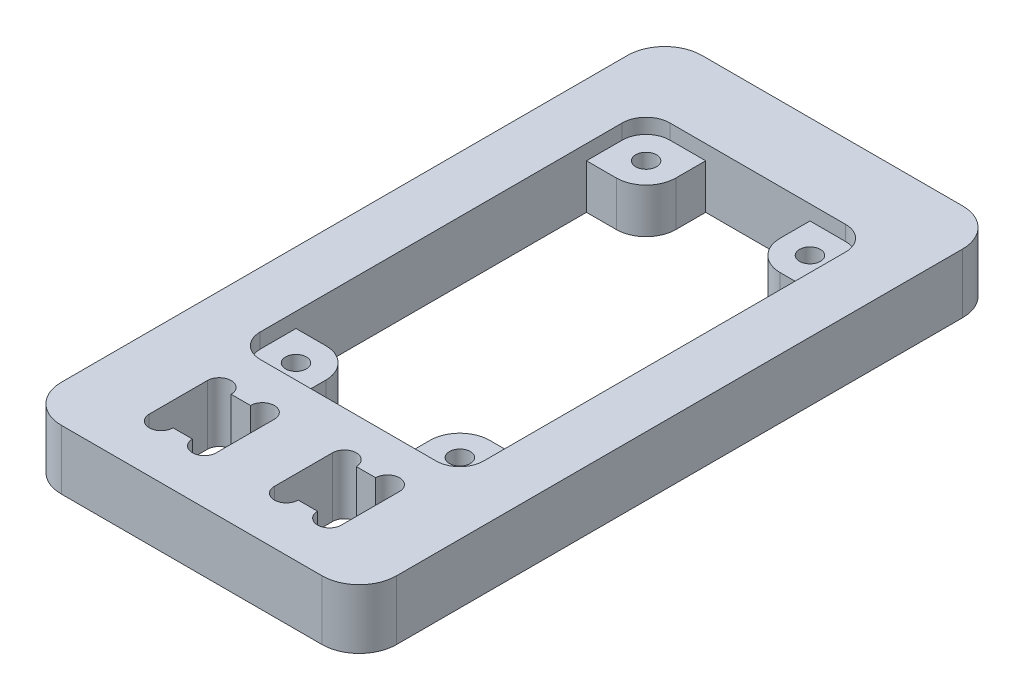
from build123d import *

# Parameters (mm, degrees)
SKETCH1_R           = 1.4
BOSS_EXTRUDE1_DEPTH = 8
CUT_EXTRUDE1_DEPTH  = 2


with BuildPart() as part:
    # Sketch1 → Boss-Extrude1 (new body)
    with BuildSketch(Plane(origin=(0, 0, 0), x_dir=(1, 0, 0), z_dir=(0, 1, 0))):
        with BuildLine():
            Line((-15, 36), (-15, -40))
            ThreePointArc((-15, -40), (-13.535533906, -43.535533906), (-10, -45))
            Line((-10, -45), (25, -45))
            ThreePointArc((25, -45), (28.535533906, -43.535533906), (30, -40))
            Line((30, -40), (30, 36))
            ThreePointArc((30, 36), (28.535533906, 39.535533906), (25, 41))
            Line((25, 41), (-10, 41))
            ThreePointArc((-10, 41), (-13.535533906, 39.535533906), (-15, 36))
        make_face()
        with Locations(Location((18.5, -20, 0), (0, 0, 270))):
            Circle(SKETCH1_R, mode=Mode.SUBTRACT)
        with Locations(Location((-3.5, -20, 0), (0, 0, 270))):
            Circle(SKETCH1_R, mode=Mode.SUBTRACT)
        with Locations(Location((18.5, 27, 0), (0, 0, 270))):
            Circle(SKETCH1_R, mode=Mode.SUBTRACT)
        with Locations(Location((-3.5, 27, 0), (0, 0, 270))):
            Circle(SKETCH1_R, mode=Mode.SUBTRACT)
        with BuildLine():
            Line((-2.2, -37.8), (0.4, -37.8))
            ThreePointArc((0.4, -37.8), (2, -39.4), (3.6, -37.8))
            Line((3.6, -37.8), (3.6, -30))
            ThreePointArc((3.6, -30), (2, -28.4), (0.4, -30))
            Line((0.4, -30), (-2.2, -30))
            ThreePointArc((-2.2, -30), (-3.8, -28.4), (-5.4, -30))
            Line((-5.4, -30), (-5.4, -37.8))
            ThreePointArc((-5.4, -37.8), (-3.8, -39.4), (-2.2, -37.8))
        make_face(mode=Mode.SUBTRACT)
        with BuildLine():
            Line((14.6, -37.8), (17.2, -37.8))
            ThreePointArc((17.2, -37.8), (18.8, -39.4), (20.4, -37.8))
            Line((20.4, -37.8), (20.4, -30))
            ThreePointArc((20.4, -30), (18.8, -28.4), (17.2, -30))
            Line((17.2, -30), (14.6, -30))
            ThreePointArc((14.6, -30), (13, -28.4), (11.4, -30))
            Line((11.4, -30), (11.4, -37.8))
            ThreePointArc((11.4, -37.8), (13, -39.4), (14.6, -37.8))
        make_face(mode=Mode.SUBTRACT)
        with BuildLine():
            Line((18.5, -16), (22.5, -16))
            Line((22.5, -16), (22.5, 23))
            Line((22.5, 23), (18.5, 23))
            ThreePointArc((18.5, 23), (15.671572875, 24.171572875), (14.5, 27))
            Line((14.5, 27), (14.5, 31))
            Line((14.5, 31), (0.5, 31))
            Line((0.5, 31), (0.5, 27))
            ThreePointArc((0.5, 27), (-0.671572875, 24.171572875), (-3.5, 23))
            Line((-3.5, 23), (-7.5, 23))
            Line((-7.5, 23), (-7.5, -16))
            Line((-7.5, -16), (-3.5, -16))
            ThreePointArc((-3.5, -16), (-0.671572875, -17.171572875), (0.5, -20))
            Line((0.5, -20), (0.5, -24))
            Line((0.5, -24), (14.5, -24))
            Line((14.5, -24), (14.5, -20))
            ThreePointArc((14.5, -20), (15.671572875, -17.171572875), (18.5, -16))
        make_face(mode=Mode.SUBTRACT)
    extrude(amount=BOSS_EXTRUDE1_DEPTH)

    # Sketch2 → Cut-Extrude1 (cut)
    with BuildSketch(Plane(origin=(0, 8, 0), x_dir=(1, 0, 0), z_dir=(0, 1, 0))):
        with BuildLine():
            Line((-4.3, 31), (19.3, 31))
            ThreePointArc((19.3, 31), (21.5627417, 30.0627417), (22.5, 27.8))
            Line((22.5, 27.8), (22.5, -20.8))
            ThreePointArc((22.5, -20.8), (21.5627417, -23.0627417), (19.3, -24))
            Line((19.3, -24), (-4.3, -24))
            ThreePointArc((-4.3, -24), (-6.5627417, -23.0627417), (-7.5, -20.8))
            Line((-7.5, -20.8), (-7.5, 27.8))
            ThreePointArc((-7.5, 27.8), (-6.5627417, 30.0627417), (-4.3, 31))
        make_face()
    extrude(amount=-CUT_EXTRUDE1_DEPTH, mode=Mode.SUBTRACT)


solid = part.part
